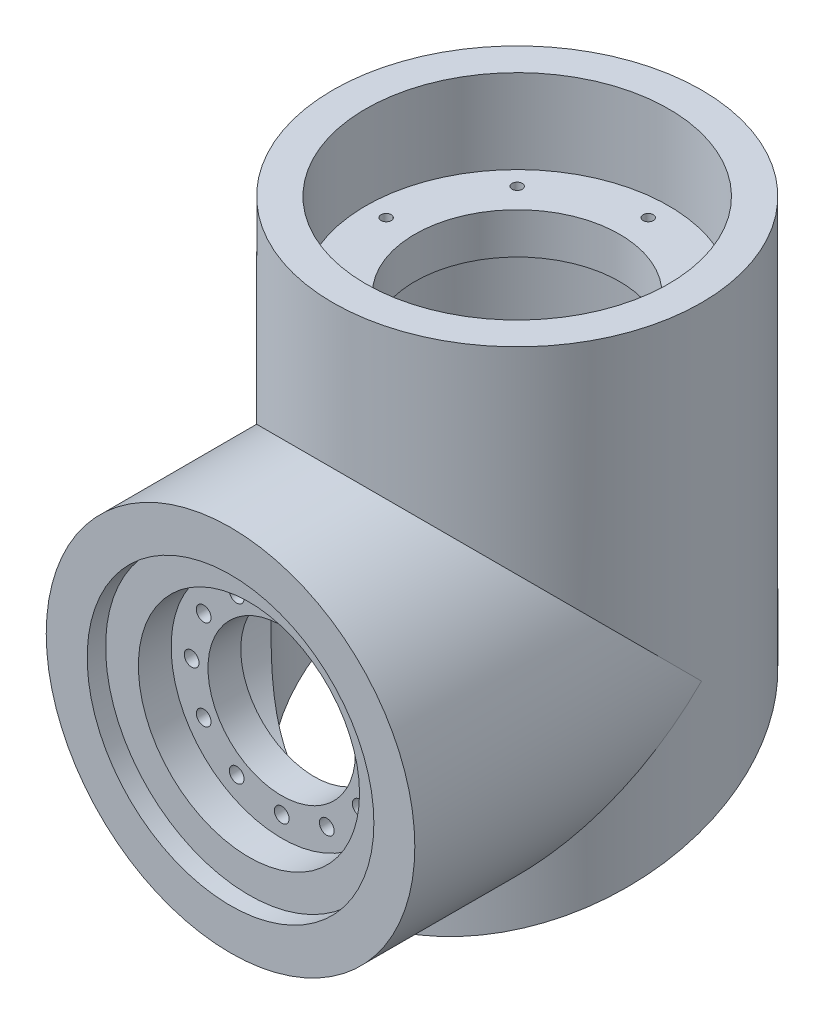
from build123d import *

# Parameters (mm, degrees)
SKETCH_1_R                = 45
EXTRUDE_1_DEPTH           = 70
EXTRUDE_2_DEPTH           = 80
EXTRUDE_2_DEPTH_BACK      = 48
SKETCH_2_R                = 45
SKETCH_3_R                = 37
CUT_EXTRUDE_1_DEPTH       = 20.5
SKETCH_5_R                = 37.5
CUT_EXTRUDE_2_DEPTH       = 97.5
SKETCH_6_R                = 42.5
CUT_EXTRUDE_3_DEPTH       = 39.9
SKETCH_7_R                = 25
CUT_EXTRUDE_4_DEPTH       = 136.945761243
PATTERN_CIRCULAR_1_COUNT  = 8
SKETCH_11_R               = 35
CUT_EXTRUDE_6_DEPTH       = 4.5
SKETCH_12_R               = 27
CUT_EXTRUDE_7_DEPTH       = 8
SKETCH_13_R               = 18
CUT_EXTRUDE_8_DEPTH       = 8
SKETCH_14_R               = 32.5
CUT_EXTRUDE_9_DEPTH       = 40
HOLE_WIZARD_1_D           = 3.6
HOLE_WIZARD_1_DEPTH       = 20.5
HOLE_WIZARD_1_CBORE_D     = 6
HOLE_WIZARD_1_CBORE_DEPTH = 3.4
PATTERN_CIRCULAR_2_COUNT  = 12
PATTERN_CIRCULAR_4_COUNT  = 5
PATTERN_CIRCULAR_4_ANGLE  = 120
CUT_EXTRUDE_10_DEPTH      = 116.433963806
CUT_EXTRUDE_10_DEPTH_BACK = 116.433963806
SKETCH_21_R               = 0.8
CUT_EXTRUDE_11_DEPTH      = 6
SKETCH_22_R               = 0.8
CUT_EXTRUDE_12_DEPTH      = 38
SKETCH_23_R               = 0.8
CUT_EXTRUDE_13_DEPTH      = 24


with BuildPart() as part:
    # 草图1 → 凸台-拉伸1 (new body)
    with BuildSketch(Plane.XY):
        Circle(SKETCH_1_R)
    extrude(amount=EXTRUDE_1_DEPTH)

    # 草图2 → 凸台-拉伸2 (add, two sides: drawn at the far end of the back side and taken through both)
    with BuildSketch(Plane(origin=(0, 0, 0), x_dir=(1, 0, 0), z_dir=(0, 1, 0)).offset(-EXTRUDE_2_DEPTH_BACK)):
        with Locations(Location((0, 0, 0), (0, 0, 270))):
            Circle(SKETCH_2_R)
    extrude(amount=EXTRUDE_2_DEPTH + EXTRUDE_2_DEPTH_BACK)

    # 草图3 → 切除-拉伸1 (cut)
    with BuildSketch(Plane(origin=(0, 80, 0), x_dir=(1, 0, 0), z_dir=(0, 1, 0))):
        with Locations(Location((0, 0, 0), (0, 0, 270))):
            Circle(SKETCH_3_R)
    extrude(amount=-CUT_EXTRUDE_1_DEPTH, mode=Mode.SUBTRACT)

    # 草图5 → 切除-拉伸2 (cut)
    with BuildSketch(Plane.XZ.offset(48)):
        with Locations(Location((0, 0, 0), (0, 0, 270))):
            Circle(SKETCH_5_R)
    extrude(amount=-CUT_EXTRUDE_2_DEPTH, mode=Mode.SUBTRACT)

    # 草图6 → 切除-拉伸3 (cut)
    with BuildSketch(Plane.XZ.offset(48)):
        with Locations(Location((0, 0, 0), (0, 0, 270))):
            Circle(SKETCH_6_R)
    extrude(amount=-CUT_EXTRUDE_3_DEPTH, mode=Mode.SUBTRACT)

    # 草图7 → 切除-拉伸4 (cut, through all)
    with BuildSketch(Plane(origin=(0, 59.5, 0), x_dir=(1, 0, 0), z_dir=(0, 1, 0))):
        with Locations(Location((0, 0, 0), (0, 0, 270))):
            Circle(SKETCH_7_R)
    extrude(amount=-CUT_EXTRUDE_4_DEPTH, mode=Mode.SUBTRACT)

    # 草图8 → M3 螺纹孔1 (revolve, cut)
    with BuildSketch(Plane(origin=(0, 59.5, -32), x_dir=(0, 0, 1), z_dir=(1, 0, 0))):
        Polygon((0, 0), (0, 8.251075774), (1.25, 7.5), (1.25, 0), align=None)
    hole_wizard_m3_1 = revolve(axis=Axis((0, 65.85, -32), (0, -1, 0)), mode=Mode.SUBTRACT)

    # 阵列(圆周)1: M3 螺纹孔1 ×8 about axis
    pattern_circular_1_axis = Axis((0, 0, 0), (0, 1, 0))
    for i in range(1, PATTERN_CIRCULAR_1_COUNT):
        add(hole_wizard_m3_1.rotate(pattern_circular_1_axis, i * 360 / PATTERN_CIRCULAR_1_COUNT), mode=Mode.SUBTRACT)

    # 草图11 → 切除-拉伸6 (cut)
    with BuildSketch(Plane.XY.offset(70)):
        Circle(SKETCH_11_R)
    extrude(amount=-CUT_EXTRUDE_6_DEPTH, mode=Mode.SUBTRACT)

    # 草图12 → 切除-拉伸7 (cut)
    with BuildSketch(Plane.XY.offset(65.5)):
        Circle(SKETCH_12_R)
    extrude(amount=-CUT_EXTRUDE_7_DEPTH, mode=Mode.SUBTRACT)

    # 草图13 → 切除-拉伸8 (cut)
    with BuildSketch(Plane.XY.offset(57.5)):
        Circle(SKETCH_13_R)
    extrude(amount=-CUT_EXTRUDE_8_DEPTH, mode=Mode.SUBTRACT)

    # 草图14 → 切除-拉伸9 (cut)
    with BuildSketch(Plane.XY.offset(49.5)):
        Circle(SKETCH_14_R)
    extrude(amount=-CUT_EXTRUDE_9_DEPTH, mode=Mode.SUBTRACT)

    # 打孔尺寸(%根据)内六角圆柱头螺钉的类型1
    with Locations(Plane(origin=(0, 0, 49.5), x_dir=(-1, 0, 0), z_dir=(0, 0, -1))):
        with Locations((-22, 0)):
            hole_wizard_1 = CounterBoreHole(HOLE_WIZARD_1_D / 2, HOLE_WIZARD_1_CBORE_D / 2, HOLE_WIZARD_1_CBORE_DEPTH, depth=HOLE_WIZARD_1_DEPTH)

    # 阵列(圆周)2: 打孔尺寸(%根据)内六角圆柱头螺钉的类型1 ×12 about axis
    pattern_circular_2_axis = Axis((0, 0, 0), (0, 0, 1))
    for i in range(1, PATTERN_CIRCULAR_2_COUNT):
        add(hole_wizard_1.rotate(pattern_circular_2_axis, i * 360 / PATTERN_CIRCULAR_2_COUNT), mode=Mode.SUBTRACT)

    # 草图17 → M3 螺纹孔2 (revolve, cut)
    with BuildSketch(Plane(origin=(0, -8.1, -39), x_dir=(0, 0, -1), z_dir=(1, 0, 0))):
        Polygon((0, 0), (0, 7.251075774), (1.25, 6.5), (1.25, 0), align=None)
    hole_wizard_m3_2 = revolve(axis=Axis((0, -14.45, -39), (0, 1, 0)), mode=Mode.SUBTRACT)

    # 阵列(圆周)4: M3 螺纹孔2 ×5 about axis
    pattern_circular_4_axis = Axis((0, 0, 0), (0, 1, 0))
    for i in range(1, PATTERN_CIRCULAR_4_COUNT):
        add(hole_wizard_m3_2.rotate(pattern_circular_4_axis, i * PATTERN_CIRCULAR_4_ANGLE / (PATTERN_CIRCULAR_4_COUNT - 1)), mode=Mode.SUBTRACT)

    # 镜向1: M3 螺纹孔2 across plane
    add(hole_wizard_m3_2.mirror(Plane(origin=(0, 0, 0), x_dir=(0, 0, 1), z_dir=(1, 0, 0))), mode=Mode.SUBTRACT)

    # 镜向1 copy 1 sketch → 镜向1 copy 1 (revolve, cut)
    with BuildSketch(Plane(origin=(19.5, -8.1, -33.774990748), x_dir=(0.5000000000000011, 0, -0.866025403784438), z_dir=(-0.866025403784438, 0, -0.5000000000000011))):
        Polygon((0, 0), (0, -7.251075774), (1.25, -6.5), (1.25, 0), align=None)
    revolve(axis=Axis((19.5, -14.45, -33.774990748), (0, -1, 0)), mode=Mode.SUBTRACT)

    # 镜向1 copy 2 sketch → 镜向1 copy 2 (revolve, cut)
    with BuildSketch(Plane(origin=(33.774990748, -8.1, -19.5), x_dir=(0.8660254037844399, 0, -0.4999999999999978), z_dir=(-0.4999999999999978, 0, -0.8660254037844399))):
        Polygon((0, 0), (0, -7.251075774), (1.25, -6.5), (1.25, 0), align=None)
    revolve(axis=Axis((33.774990748, -14.45, -19.5), (0, -1, 0)), mode=Mode.SUBTRACT)

    # 镜向1 copy 3 sketch → 镜向1 copy 3 (revolve, cut)
    with BuildSketch(Plane(origin=(39, -8.1, 0), x_dir=(1, 0, 0), z_dir=(0, 0, -1))):
        Polygon((0, 0), (0, -7.251075774), (1.25, -6.5), (1.25, 0), align=None)
    revolve(axis=Axis((39, -14.45, 0), (0, -1, 0)), mode=Mode.SUBTRACT)

    # 镜向1 copy 4 sketch → 镜向1 copy 4 (revolve, cut)
    with BuildSketch(Plane(origin=(33.774990748, -8.1, 19.5), x_dir=(0.866025403784436, 0, 0.5000000000000044), z_dir=(0.5000000000000044, 0, -0.866025403784436))):
        Polygon((0, 0), (0, -7.251075774), (1.25, -6.5), (1.25, 0), align=None)
    revolve(axis=Axis((33.774990748, -14.45, 19.5), (0, -1, 0)), mode=Mode.SUBTRACT)

    # 草图19 → 切除-拉伸10 (cut, two sides: drawn at the far end of the back side and taken through both)
    with BuildSketch(Plane(origin=(0, 0, 0), x_dir=(0, 0, -1), z_dir=(1, 0, 0)).offset(-CUT_EXTRUDE_10_DEPTH_BACK)):
        Polygon((-45, -48), (45, -48), (45, -15.242678916), align=None)
    extrude(amount=CUT_EXTRUDE_10_DEPTH + CUT_EXTRUDE_10_DEPTH_BACK, mode=Mode.SUBTRACT)

    # 草图21 → 切除-拉伸11 (cut)
    with BuildSketch(Plane(origin=(0, -48, 0), x_dir=(1, 0, 0), z_dir=(0, 1, 0))):
        with Locations(Location((0, -43.75, 0), (0, 0, 270))):
            Circle(SKETCH_21_R)
    extrude(amount=CUT_EXTRUDE_11_DEPTH, mode=Mode.SUBTRACT)

    # 草图22 → 切除-拉伸12 (cut)
    with BuildSketch(Plane(origin=(0, -48, 0), x_dir=(1, 0, 0), z_dir=(0, 1, 0))):
        with Locations(Location((0, 43.75, 0), (0, 0, 270))):
            Circle(SKETCH_22_R)
    extrude(amount=CUT_EXTRUDE_12_DEPTH, mode=Mode.SUBTRACT)

    # 草图23 → 切除-拉伸13 (cut)
    with BuildSketch(Plane(origin=(0, -48, 0), x_dir=(1, 0, 0), z_dir=(0, 1, 0))):
        with Locations(Location((-43.75, 0, 0), (0, 0, 270))):
            Circle(SKETCH_23_R)
        with Locations(Location((43.75, 0, 0), (0, 0, 270))):
            Circle(SKETCH_23_R)
    extrude(amount=CUT_EXTRUDE_13_DEPTH, mode=Mode.SUBTRACT)


solid = part.part
